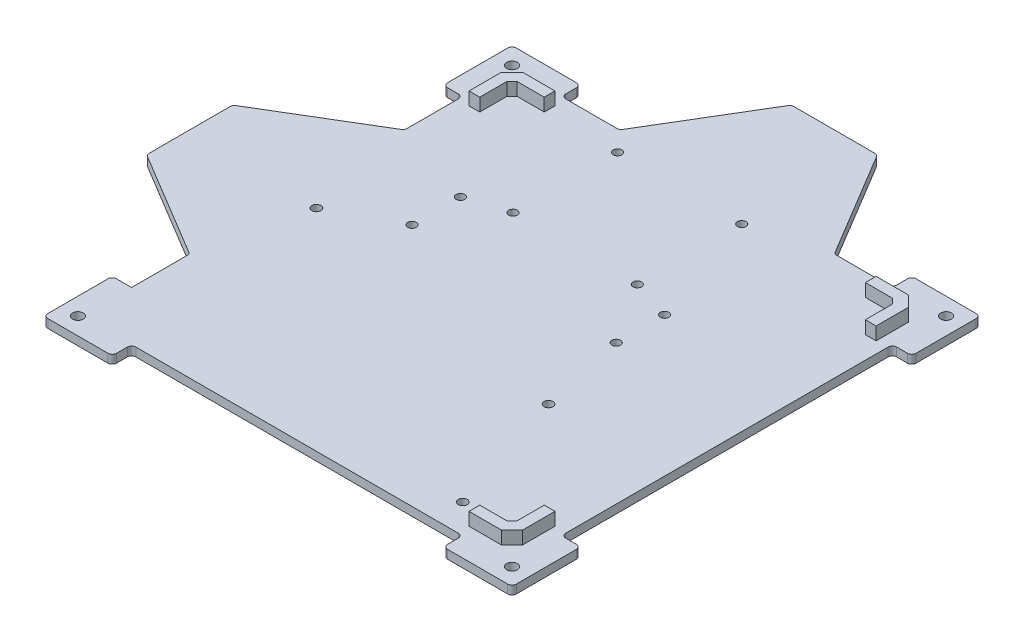
from build123d import *

# Parameters (mm, degrees)
ESQUISSE1_R             = 2.5
BOSS_EXTRU_1_DEPTH      = 4
ESQUISSE2_R             = 2.1
ESQUISSE2_R_2           = 2
ENL_V_MAT_EXTRU_1_DEPTH = 4
BOSS_EXTRU_2_DEPTH      = 6
CONG_1_R                = 2


with BuildPart() as part:
    # Esquisse1 → Boss.-Extru.1 (new body)
    with BuildSketch(Plane(origin=(0, 0, 0), x_dir=(1, 0, 0), z_dir=(0, 1, 0))):
        Polygon((0, 218), (0, 186), (9, 186), (9, 159), (-41, 129), (-41, 89), (9, 59), (9, 32), (0, 32), (0, 0), (32, 0), (32, 9), (186, 9), (186, 0), (218, 0), (218, 32), (209, 32), (209, 186), (218, 186), (218, 218), (186, 218), (186, 209), (159, 209), (129, 259), (89, 259), (59, 209), (32, 209), (32, 218), align=None)
        with Locations(Location((8, 210, 0), (0, 0, 270))):
            Circle(ESQUISSE1_R, mode=Mode.SUBTRACT)
        with Locations(Location((210, 210, 0), (0, 0, 270))):
            Circle(ESQUISSE1_R, mode=Mode.SUBTRACT)
        with Locations(Location((210, 8, 0), (0, 0, 270))):
            Circle(ESQUISSE1_R, mode=Mode.SUBTRACT)
        with Locations(Location((8, 8, 0), (0, 0, 270))):
            Circle(ESQUISSE1_R, mode=Mode.SUBTRACT)
    extrude(amount=BOSS_EXTRU_1_DEPTH)

    # Esquisse2 → Enlèv. mat.-Extru.1 (cut)
    with BuildSketch(Plane(origin=(0, 4, 0), x_dir=(1, 0, 0), z_dir=(0, 1, 0))):
        with Locations(Location((172.5, 22.6, 0), (0, 0, 90))):
            Circle(ESQUISSE2_R)
        with Locations(Location((153, 82, 0), (0, 0, 90))):
            Circle(ESQUISSE2_R)
        with Locations(Location((20, 107, 0), (0, 0, 90))):
            Circle(ESQUISSE2_R)
        with Locations(Location((49, 122.5, 0), (0, 0, 270))):
            Circle(ESQUISSE2_R_2)
        with Locations(Location((144, 122.5, 0), (0, 0, 270))):
            Circle(ESQUISSE2_R_2)
        with Locations(Location((144, 145, 0), (0, 0, 270))):
            Circle(ESQUISSE2_R_2)
        with Locations(Location((49, 145, 0), (0, 0, 270))):
            Circle(ESQUISSE2_R_2)
        with Locations(Location((67.6, 199.5, 0), (0, 0, 270))):
            Circle(ESQUISSE2_R_2)
        with Locations(Location((67.6, 150.9, 0), (0, 0, 270))):
            Circle(ESQUISSE2_R_2)
        with Locations(Location((125.4, 150.9, 0), (0, 0, 90))):
            Circle(ESQUISSE2_R_2)
        with Locations(Location((125.4, 199.5, 0), (0, 0, 90))):
            Circle(ESQUISSE2_R_2)
    extrude(amount=-ENL_V_MAT_EXTRU_1_DEPTH, mode=Mode.SUBTRACT)

    # Esquisse4 → Boss.-Extru.2 (add)
    with BuildSketch(Plane(origin=(0, 4, 0), x_dir=(1, 0, 0), z_dir=(0, 1, 0))):
        Polygon((198.7, 14.3), (183.7, 14.3), (183.7, 19.3), (196.353215425, 19.3), (198.7, 21.646784575), (198.7, 34.3), (203.7, 34.3), (203.7, 19.3), align=None)
        Polygon((19.3, 203.7), (34.3, 203.7), (34.3, 198.7), (21.646784575, 198.7), (19.3, 196.353215425), (19.3, 183.7), (14.3, 183.7), (14.3, 198.7), align=None)
        Polygon((203.7, 198.7), (203.7, 183.7), (198.7, 183.7), (198.7, 196.353215425), (196.353215425, 198.7), (183.7, 198.7), (183.7, 203.7), (198.7, 203.7), align=None)
    extrude(amount=BOSS_EXTRU_2_DEPTH)

    # Congé1
    cong_1_edges = [part.edges().sort_by_distance(p)[0] for p in [
        (0, 2, 0),
        (0, 2, -32),
        (9, 2, -59),
        (-41, 2, -89),
        (-41, 2, -129),
        (9, 2, -159),
        (9, 2, -186),
        (0, 2, -186),
        (0, 2, -218),
        (32, 2, -218),
        (32, 2, -209),
        (59, 2, -209),
        (89, 2, -259),
        (129, 2, -259),
        (159, 2, -209),
        (186, 2, -209),
        (186, 2, -218),
        (218, 2, -218),
        (218, 2, -186),
        (209, 2, -186),
        (209, 2, -32),
        (218, 2, -32),
        (218, 2, 0),
        (186, 2, 0),
        (186, 2, -9),
        (32, 2, -9),
        (32, 2, 0),
    ]]
    fillet(cong_1_edges, radius=CONG_1_R)


solid = part.part
